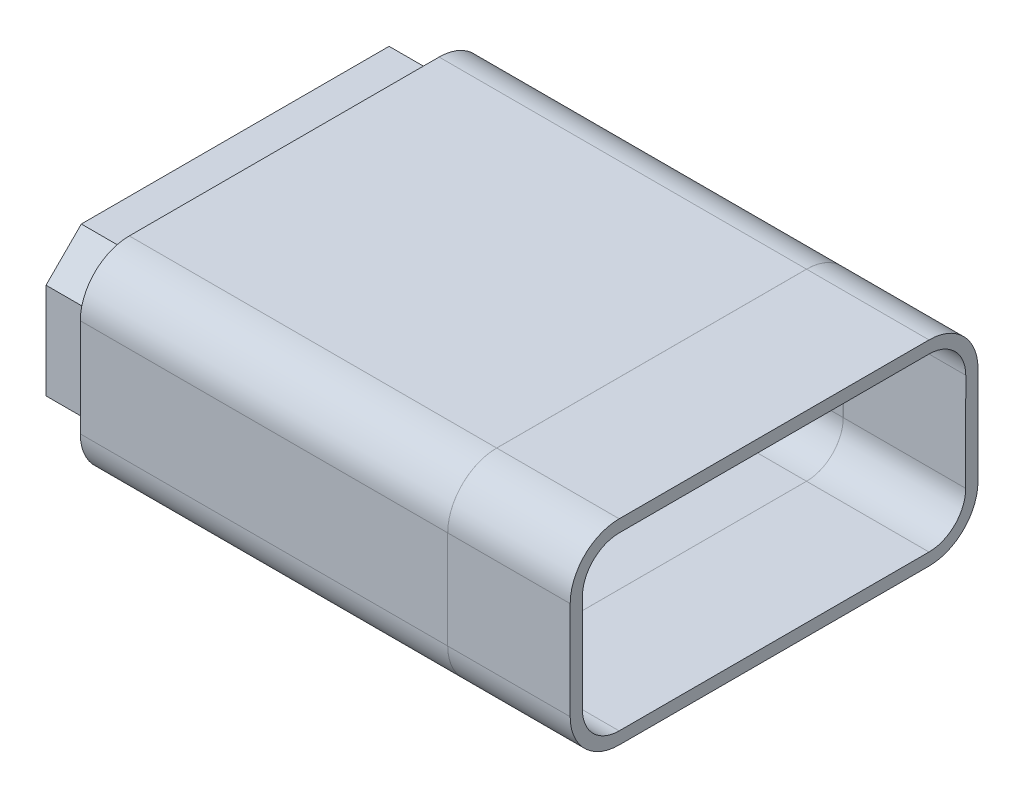
from build123d import *

# Parameters (mm, degrees)
BOSS_EXTRUDE7_DEPTH        = 4
CUT_EXTRUDE1_DEPTH         = 4
CUT_EXTRUDE5_SCIECIA_DEPTH = 4


with BuildPart() as part:
    # Sweep1: sweep along a path in Sketch2path
    with BuildLine(Plane.XY) as sweep1_path:
        Line((40.002617842, -0.001745558), (30.002617994, -2.28e-07))
        ThreePointArc((30.002617994, -2.28e-07), (30.001308997, -5.7e-08), (30, 0))
        Line((30, 0), (0, 0))
    # Sketch3 → Sweep1 (sweep)
    with BuildSketch(Plane(origin=(0, 0, 0), x_dir=(0, 0, -1), z_dir=(1, 0, 0))):
        with BuildLine():
            Line((-16.65, -4), (-16.65, 4))
            ThreePointArc((-16.65, 4), (-15.478427125, 6.828427125), (-12.65, 8))
            Line((-12.65, 8), (12.65, 8))
            ThreePointArc((12.65, 8), (15.478427125, 6.828427125), (16.65, 4))
            Line((16.65, 4), (16.65, -4))
            ThreePointArc((16.65, -4), (15.478427125, -6.828427125), (12.65, -8))
            Line((12.65, -8), (-12.65, -8))
            ThreePointArc((-12.65, -8), (-15.478427125, -6.828427125), (-16.65, -4))
        make_face()
        with BuildLine():
            Line((-15.65, -4), (-15.65, 4))
            ThreePointArc((-15.65, 4), (-14.771320344, 6.121320344), (-12.65, 7))
            Line((-12.65, 7), (12.65, 7))
            ThreePointArc((12.65, 7), (14.771320344, 6.121320344), (15.65, 4))
            Line((15.65, 4), (15.65, -4))
            ThreePointArc((15.65, -4), (14.771320344, -6.121320344), (12.65, -7))
            Line((12.65, -7), (-12.65, -7))
            ThreePointArc((-12.65, -7), (-14.771320344, -6.121320344), (-15.65, -4))
        make_face(mode=Mode.SUBTRACT)
    sweep(path=sweep1_path.line)

    # Sketch14 → Boss-Extrude7 (add, symmetric)
    with BuildSketch(Plane.ZY):
        with BuildLine():
            Line((-15.65, -4), (-15.65, 4))
            ThreePointArc((-15.65, 4), (-14.771320344, 6.121320344), (-12.65, 7))
            Line((-12.65, 7), (12.65, 7))
            ThreePointArc((12.65, 7), (14.771320344, 6.121320344), (15.65, 4))
            Line((15.65, 4), (15.65, -4))
            ThreePointArc((15.65, -4), (14.771320344, -6.121320344), (12.65, -7))
            Line((12.65, -7), (-12.65, -7))
            ThreePointArc((-12.65, -7), (-14.771320344, -6.121320344), (-15.65, -4))
        make_face()
        with BuildLine():
            Line((-12.65, 5.8), (12.65, 5.8))
            ThreePointArc((12.65, 5.8), (13.922792206, 5.272792206), (14.45, 4))
            Line((14.45, 4), (14.45, -4))
            ThreePointArc((14.45, -4), (13.922792206, -5.272792206), (12.65, -5.8))
            Line((12.65, -5.8), (-12.65, -5.8))
            ThreePointArc((-12.65, -5.8), (-13.922792206, -5.272792206), (-14.45, -4))
            Line((-14.45, -4), (-14.45, 4))
            ThreePointArc((-14.45, 4), (-13.922792206, 5.272792206), (-12.65, 5.8))
        make_face(mode=Mode.SUBTRACT)
    extrude(amount=BOSS_EXTRUDE7_DEPTH, both=True)

    # Sketch15 → Cut-Extrude1 (cut)
    with BuildSketch(Plane.ZY.offset(4)):
        with BuildLine():
            Line((-12.65, -7), (12.65, -7))
            ThreePointArc((12.65, -7), (14.771320344, -6.121320344), (15.65, -4))
            Line((15.65, -4), (15.65, 4))
            ThreePointArc((15.65, 4), (14.771320344, 6.121320344), (12.65, 7))
            Line((12.65, 7), (-12.65, 7))
            ThreePointArc((-12.65, 7), (-14.771320344, 6.121320344), (-15.65, 4))
            Line((-15.65, 4), (-15.65, -4))
            ThreePointArc((-15.65, -4), (-14.771320344, -6.121320344), (-12.65, -7))
        make_face()
        with BuildLine():
            Line((-15.45, 4), (-15.45, -4))
            ThreePointArc((-15.45, -4), (-14.629898987, -5.979898987), (-12.65, -6.8))
            Line((-12.65, -6.8), (12.65, -6.8))
            ThreePointArc((12.65, -6.8), (14.629898987, -5.979898987), (15.45, -4))
            Line((15.45, -4), (15.45, 4))
            ThreePointArc((15.45, 4), (14.629898987, 5.979898987), (12.65, 6.8))
            Line((12.65, 6.8), (-12.65, 6.8))
            ThreePointArc((-12.65, 6.8), (-14.629898987, 5.979898987), (-15.45, 4))
        make_face(mode=Mode.SUBTRACT)
    extrude(amount=-CUT_EXTRUDE1_DEPTH, mode=Mode.SUBTRACT)

    # Sketch20 → Cut-Extrude5 sciecia (cut)
    with BuildSketch(Plane.ZY.offset(4)):
        with BuildLine():
            Line((16.65, 2.715147186), (16.65, 4))
            ThreePointArc((16.65, 4), (15.478427125, 6.828427125), (12.65, 8))
            Line((12.65, 8), (11.365147186, 8))
            Line((11.365147186, 8), (16.65, 2.715147186))
        make_face()
        with BuildLine():
            Line((-11.365147186, 8), (-12.65, 8))
            ThreePointArc((-12.65, 8), (-15.478427125, 6.828427125), (-16.65, 4))
            Line((-16.65, 4), (-16.65, 2.715147186))
            Line((-16.65, 2.715147186), (-11.365147186, 8))
        make_face()
        with BuildLine():
            Line((11.365147186, -8), (12.65, -8))
            ThreePointArc((12.65, -8), (15.478427125, -6.828427125), (16.65, -4))
            Line((16.65, -4), (16.65, -2.715147186))
            Line((16.65, -2.715147186), (11.365147186, -8))
        make_face()
        with BuildLine():
            Line((-16.65, -2.715147186), (-16.65, -4))
            ThreePointArc((-16.65, -4), (-15.478427125, -6.828427125), (-12.65, -8))
            Line((-12.65, -8), (-11.365147186, -8))
            Line((-11.365147186, -8), (-16.65, -2.715147186))
        make_face()
    extrude(amount=-CUT_EXTRUDE5_SCIECIA_DEPTH, mode=Mode.SUBTRACT)


solid = part.part
